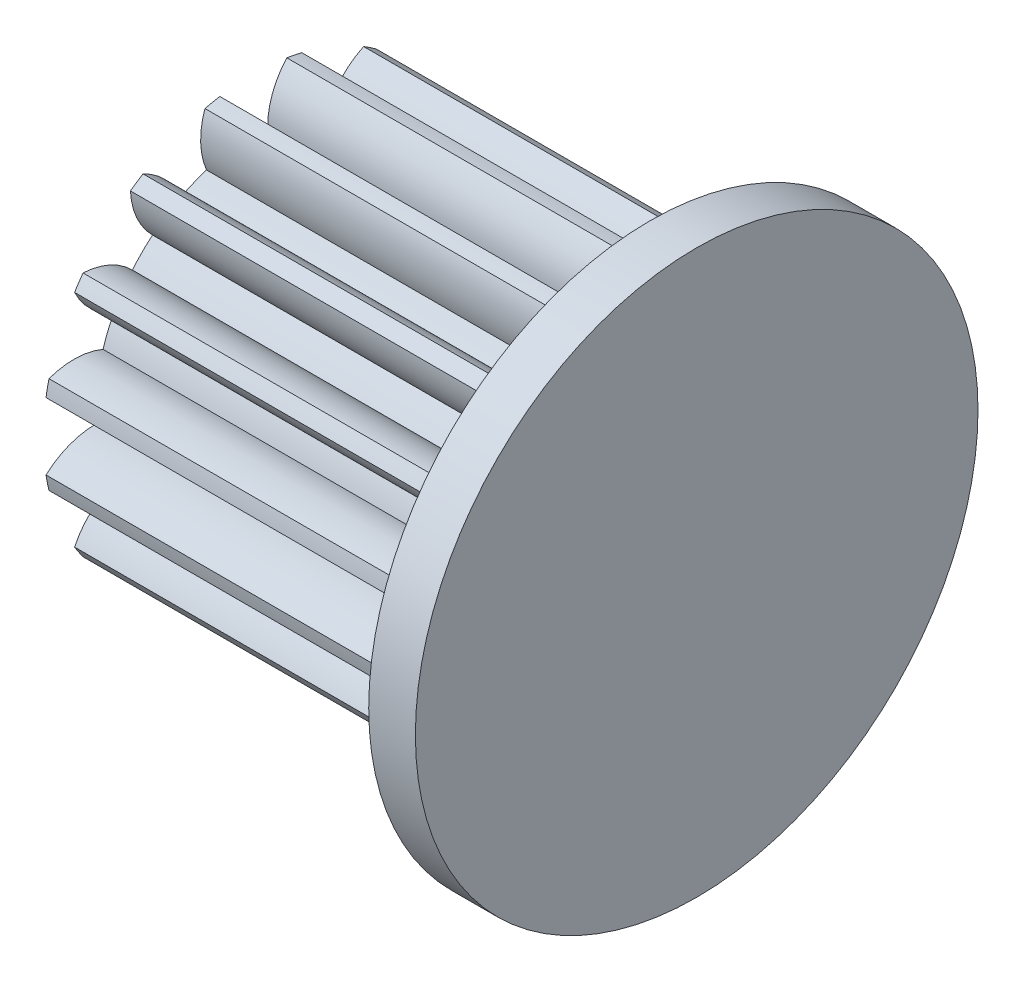
from build123d import *

# Parameters (mm, degrees)
BASPROSKE_W             = 7.5
BASPROSKE_H             = 4.5
TOOTHCUT_DEPTH          = 10.836157786
TEETHCUTS_COUNT         = 16
TEETHCUTS_ANGLE         = 337.5
BORSKE_R                = 2.5
BORE_DEPTH              = 50.0000508
ESQUISSE5_R             = 6.027848577
ESQUISSE5_R_2           = 2.85
BOSS_EXTRU_4_DEPTH      = 1
BOSS_EXTRU_6_START      = -8.5
ESQUISSE7_R             = 3.00711341
BOSS_EXTRU_6_DEPTH      = 8.5
BOSS_EXTRU_7_START      = 1
BOSS_EXTRU_7_DEPTH      = 1
ESQUISSE9_R             = 3.25
ENL_V_MAT_EXTRU_1_DEPTH = 5.5


with BuildPart() as part:
    # BasProSke → Base-Revolve (revolve)
    with BuildSketch(Plane(origin=(0, 0, 0), x_dir=(1, 0, 0), z_dir=(0, 1, 0)), mode=Mode.PRIVATE) as base_revolve_sk:
        with Locations((3.75, 2.25)):
            Rectangle(BASPROSKE_W, BASPROSKE_H)
    revolve(base_revolve_sk.sketch.rotate(Axis((-10, 0, 0), (1, 0, 0)), 180), axis=Axis((-10, 0, 0), (1, 0, 0)))

    # TooCutSke → ToothCut (cut, through all)
    with BuildSketch(Plane(origin=(0, 0, 0), x_dir=(0, 0, -1), z_dir=(1, 0, 0))):
        with BuildLine():
            ThreePointArc((0.306025637, 3.360092902), (0, 3.374), (-0.306025637, 3.360092902))
            ThreePointArc((-0.306025637, 3.360092902), (-0.415941512, 3.953968919), (-0.738171669, 4.464789776))
            ThreePointArc((-0.738171669, 4.464789776), (0, 4.5254), (0.738171669, 4.464789776))
            ThreePointArc((0.738171669, 4.464789776), (0.415941512, 3.953968919), (0.306025637, 3.360092902))
        make_face()
    toothcut = extrude(amount=TOOTHCUT_DEPTH, mode=Mode.SUBTRACT)

    # TeethCuts: ToothCut ×16 about axis
    teethcuts_axis = Axis((-10, 0, 0), (1, 0, 0))
    for i in range(1, TEETHCUTS_COUNT):
        add(toothcut.rotate(teethcuts_axis, i * TEETHCUTS_ANGLE / (TEETHCUTS_COUNT - 1)), mode=Mode.SUBTRACT)

    # BorSke → Bore (cut, symmetric)
    with BuildSketch(Plane(origin=(0, 0, 0), x_dir=(0, 0, -1), z_dir=(1, 0, 0))):
        with Locations(Location((0, 0, 0), (0, 0, 180))):
            Circle(BORSKE_R)
    extrude(amount=BORE_DEPTH, both=True, mode=Mode.SUBTRACT)

    # Esquisse5 → Boss.-Extru.4 (add)
    with BuildSketch(Plane(origin=(7.5, 0, 0), x_dir=(0, 0, -1), z_dir=(1, 0, 0))):
        Circle(ESQUISSE5_R)
        Circle(ESQUISSE5_R_2, mode=Mode.SUBTRACT)
    extrude(amount=BOSS_EXTRU_4_DEPTH)

    # Esquisse7 → Boss.-Extru.6 (add)
    with BuildSketch(Plane.ZY.offset(BOSS_EXTRU_6_START)):
        Circle(ESQUISSE7_R)
    extrude(amount=BOSS_EXTRU_6_DEPTH)

    # Esquisse8 → Boss.-Extru.7 (add)
    with BuildSketch(Plane.ZY.offset(BOSS_EXTRU_7_START)):
        with BuildLine():
            ThreePointArc((3.360092902, 0.306025637), (3.939792443, 0.410473293), (4.442413227, 0.717610424))
            ThreePointArc((4.442413227, 0.717610424), (4.413533762, 0.877906449), (4.378872276, 1.037052359))
            ThreePointArc((4.378872276, 1.037052359), (3.796974929, 1.128465421), (3.221432001, 1.003121062))
            ThreePointArc((3.221432001, 1.003121062), (3.117169543, 1.291173901), (2.987210118, 1.568582707))
            ThreePointArc((2.987210118, 1.568582707), (3.482812272, 1.886921168), (3.829637035, 2.363023525))
            ThreePointArc((3.829637035, 2.363023525), (3.741613255, 2.500066049), (3.648687715, 2.633833321))
            ThreePointArc((3.648687715, 2.633833321), (3.076102401, 2.495605504), (2.59233728, 2.159551673))
            ThreePointArc((2.59233728, 2.159551673), (2.38577828, 2.38577828), (2.159551673, 2.59233728))
            ThreePointArc((2.159551673, 2.59233728), (2.495605504, 3.076102401), (2.633833321, 3.648687715))
            ThreePointArc((2.633833321, 3.648687715), (2.500066049, 3.741613255), (2.363023525, 3.829637035))
            ThreePointArc((2.363023525, 3.829637035), (1.886921168, 3.482812272), (1.568582707, 2.987210118))
            ThreePointArc((1.568582707, 2.987210118), (1.291173901, 3.117169543), (1.003121062, 3.221432001))
            ThreePointArc((1.003121062, 3.221432001), (1.128465421, 3.796974929), (1.037052359, 4.378872276))
            ThreePointArc((1.037052359, 4.378872276), (0.877906449, 4.413533762), (0.717610424, 4.442413227))
            ThreePointArc((0.717610424, 4.442413227), (0.410473293, 3.939792443), (0.306025637, 3.360092902))
            ThreePointArc((0.306025637, 3.360092902), (0, 3.374), (-0.306025637, 3.360092902))
            ThreePointArc((-0.306025637, 3.360092902), (-0.410473293, 3.939792443), (-0.717610424, 4.442413227))
            ThreePointArc((-0.717610424, 4.442413227), (-0.877906449, 4.413533762), (-1.037052359, 4.378872276))
            ThreePointArc((-1.037052359, 4.378872276), (-1.128465421, 3.796974929), (-1.003121062, 3.221432001))
            ThreePointArc((-1.003121062, 3.221432001), (-1.291173901, 3.117169543), (-1.568582707, 2.987210118))
            ThreePointArc((-1.568582707, 2.987210118), (-1.886921168, 3.482812272), (-2.363023525, 3.829637035))
            ThreePointArc((-2.363023525, 3.829637035), (-2.500066049, 3.741613255), (-2.633833321, 3.648687715))
            ThreePointArc((-2.633833321, 3.648687715), (-2.495605504, 3.076102401), (-2.159551673, 2.59233728))
            ThreePointArc((-2.159551673, 2.59233728), (-2.38577828, 2.38577828), (-2.59233728, 2.159551673))
            ThreePointArc((-2.59233728, 2.159551673), (-3.076102401, 2.495605504), (-3.648687715, 2.633833321))
            ThreePointArc((-3.648687715, 2.633833321), (-3.741613255, 2.500066049), (-3.829637035, 2.363023525))
            ThreePointArc((-3.829637035, 2.363023525), (-3.482812272, 1.886921168), (-2.987210118, 1.568582707))
            ThreePointArc((-2.987210118, 1.568582707), (-3.117169543, 1.291173901), (-3.221432001, 1.003121062))
            ThreePointArc((-3.221432001, 1.003121062), (-3.796974929, 1.128465421), (-4.378872276, 1.037052359))
            ThreePointArc((-4.378872276, 1.037052359), (-4.413533762, 0.877906449), (-4.442413227, 0.717610424))
            ThreePointArc((-4.442413227, 0.717610424), (-3.939792443, 0.410473293), (-3.360092902, 0.306025637))
            ThreePointArc((-3.360092902, 0.306025637), (-3.374, 0), (-3.360092902, -0.306025637))
            ThreePointArc((-3.360092902, -0.306025637), (-3.939792443, -0.410473293), (-4.442413227, -0.717610424))
            ThreePointArc((-4.442413227, -0.717610424), (-4.413533762, -0.877906449), (-4.378872276, -1.037052359))
            ThreePointArc((-4.378872276, -1.037052359), (-3.796974929, -1.128465421), (-3.221432001, -1.003121062))
            ThreePointArc((-3.221432001, -1.003121062), (-3.117169543, -1.291173901), (-2.987210118, -1.568582707))
            ThreePointArc((-2.987210118, -1.568582707), (-3.482812272, -1.886921168), (-3.829637035, -2.363023525))
            ThreePointArc((-3.829637035, -2.363023525), (-3.741613255, -2.500066049), (-3.648687715, -2.633833321))
            ThreePointArc((-3.648687715, -2.633833321), (-3.076102401, -2.495605504), (-2.59233728, -2.159551673))
            ThreePointArc((-2.59233728, -2.159551673), (-2.38577828, -2.38577828), (-2.159551673, -2.59233728))
            ThreePointArc((-2.159551673, -2.59233728), (-2.495605504, -3.076102401), (-2.633833321, -3.648687715))
            ThreePointArc((-2.633833321, -3.648687715), (-2.500066049, -3.741613255), (-2.363023525, -3.829637035))
            ThreePointArc((-2.363023525, -3.829637035), (-1.886921168, -3.482812272), (-1.568582707, -2.987210118))
            ThreePointArc((-1.568582707, -2.987210118), (-1.291173901, -3.117169543), (-1.003121062, -3.221432001))
            ThreePointArc((-1.003121062, -3.221432001), (-1.128465421, -3.796974929), (-1.037052359, -4.378872276))
            ThreePointArc((-1.037052359, -4.378872276), (-0.877906449, -4.413533762), (-0.717610424, -4.442413227))
            ThreePointArc((-0.717610424, -4.442413227), (-0.410473293, -3.939792443), (-0.306025637, -3.360092902))
            ThreePointArc((-0.306025637, -3.360092902), (0, -3.374), (0.306025637, -3.360092902))
            ThreePointArc((0.306025637, -3.360092902), (0.410473293, -3.939792443), (0.717610424, -4.442413227))
            ThreePointArc((0.717610424, -4.442413227), (0.877906449, -4.413533762), (1.037052359, -4.378872276))
            ThreePointArc((1.037052359, -4.378872276), (1.128465421, -3.796974929), (1.003121062, -3.221432001))
            ThreePointArc((1.003121062, -3.221432001), (1.291173901, -3.117169543), (1.568582707, -2.987210118))
            ThreePointArc((1.568582707, -2.987210118), (1.886921168, -3.482812272), (2.363023525, -3.829637035))
            ThreePointArc((2.363023525, -3.829637035), (2.500066049, -3.741613255), (2.633833321, -3.648687715))
            ThreePointArc((2.633833321, -3.648687715), (2.495605504, -3.076102401), (2.159551673, -2.59233728))
            ThreePointArc((2.159551673, -2.59233728), (2.38577828, -2.38577828), (2.59233728, -2.159551673))
            ThreePointArc((2.59233728, -2.159551673), (3.076102401, -2.495605504), (3.648687715, -2.633833321))
            ThreePointArc((3.648687715, -2.633833321), (3.741613255, -2.500066049), (3.829637035, -2.363023525))
            ThreePointArc((3.829637035, -2.363023525), (3.482812272, -1.886921168), (2.987210118, -1.568582707))
            ThreePointArc((2.987210118, -1.568582707), (3.117169543, -1.291173901), (3.221432001, -1.003121062))
            ThreePointArc((3.221432001, -1.003121062), (3.796974929, -1.128465421), (4.378872276, -1.037052359))
            ThreePointArc((4.378872276, -1.037052359), (4.413533762, -0.877906449), (4.442413227, -0.717610424))
            ThreePointArc((4.442413227, -0.717610424), (3.939792443, -0.410473293), (3.360092902, -0.306025637))
            ThreePointArc((3.360092902, -0.306025637), (3.374, 0), (3.360092902, 0.306025637))
        make_face()
    extrude(amount=-BOSS_EXTRU_7_DEPTH)

    # Esquisse9 → Enlèv. mat.-Extru.1 (cut)
    with BuildSketch(Plane.ZY.offset(1)):
        Circle(ESQUISSE9_R)
    extrude(amount=-ENL_V_MAT_EXTRU_1_DEPTH, mode=Mode.SUBTRACT)


solid = part.part
